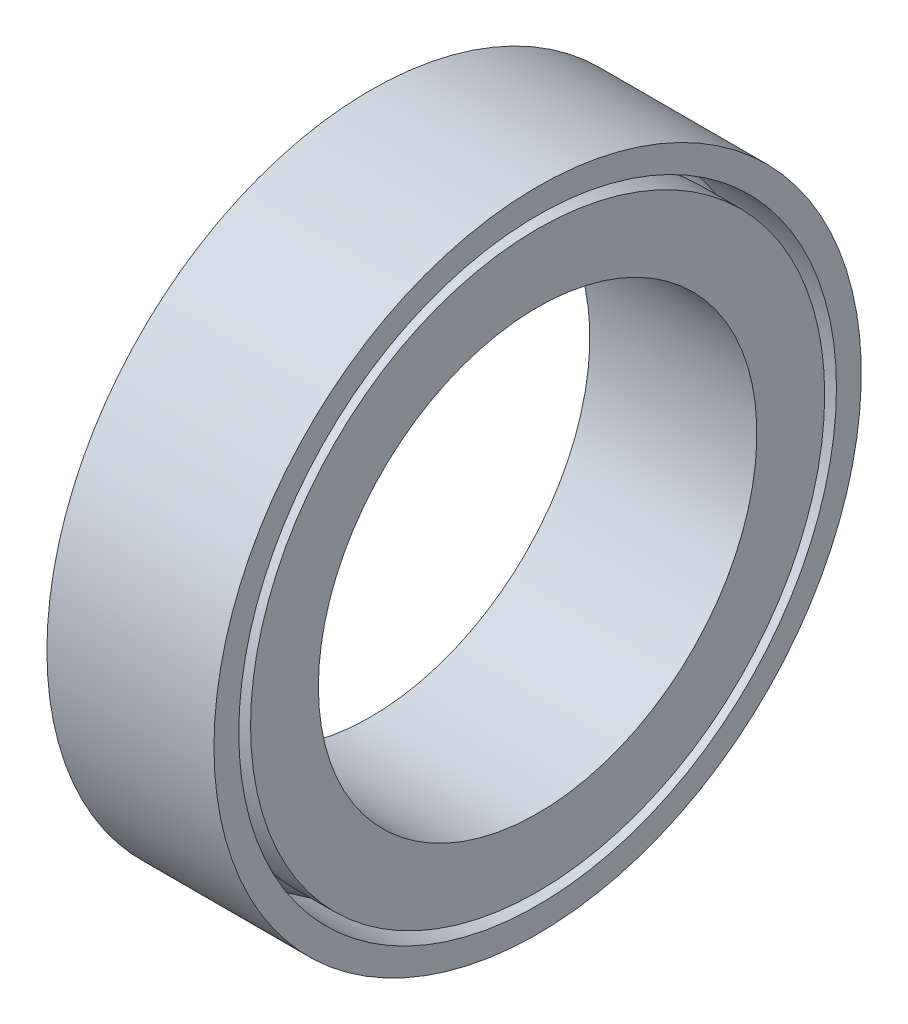
from build123d import *


with BuildPart() as part:
    # 草图1 → 旋转2 (revolve)
    with BuildSketch(Plane.XY, mode=Mode.PRIVATE) as revolve_2_sk:
        with BuildLine():
            Line((0, 15.5), (0, 10.5))
            Line((0, 10.5), (8, 10.5))
            Line((8, 10.5), (8, 13.74763638))
            Line((8, 13.74763638), (5.982258283, 13.74763638))
            Line((5.982258283, 13.74763638), (5.982258283, 12.056029289))
            Line((5.982258283, 12.056029289), (4.590479573, 12.056029289))
            ThreePointArc((4.590479573, 12.056029289), (4.409304115, 12.040143863), (4.228128656, 12.056029289))
            Line((4.228128656, 12.056029289), (2.789681799, 12.056029289))
            Line((2.789681799, 12.056029289), (2.789681799, 14.312073179))
            Line((2.789681799, 14.312073179), (8, 14.312073179))
            Line((8, 14.312073179), (8, 15.5))
            Line((8, 15.5), (0, 15.5))
        make_face()
        with BuildLine():
            Line((4.228128656, 12.056029289), (4.590479573, 12.056029289))
            ThreePointArc((4.590479573, 12.056029289), (4.409304115, 14.122360164), (4.228128656, 12.056029289))
        make_face()
    revolve(revolve_2_sk.sketch.rotate(Axis((0, 0, 0), (1, 0, 0)), 90), axis=Axis((0, 0, 0), (1, 0, 0)))


solid = part.part
